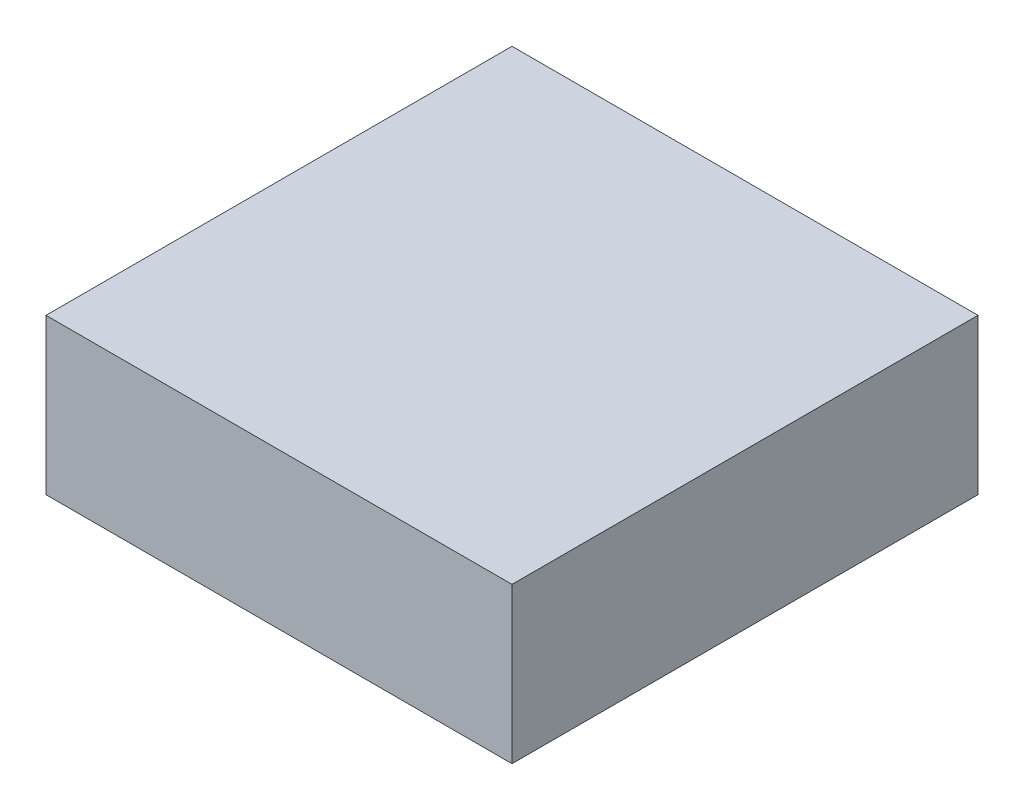
from build123d import *

# Parameters (mm, degrees)
SKETCH11_W          = 81
SKETCH11_H          = 81
BOSS_EXTRUDE1_DEPTH = 27


with BuildPart() as part:
    # Sketch11 → Boss-Extrude1 (new body)
    with BuildSketch(Plane(origin=(0, 0, 0), x_dir=(1, 0, 0), z_dir=(0, 1, 0))):
        Rectangle(SKETCH11_W, SKETCH11_H)
    extrude(amount=BOSS_EXTRUDE1_DEPTH)

    # Sketch1 → Cut-Revolve1 (revolve, cut)
    with BuildSketch(Plane.XY):
        with BuildLine():
            Line((0, 25), (0, 10))
            Line((0, 10), (0, -10))
            Line((0, -10), (31.5, -10))
            Line((31.5, -10), (31.5, 0))
            add(Edge.make_bspline(
                [(0, 25), (1.37149288, 25), (4.090224786, 24.302680674), (10.751491586, 17.136812446), (25.578767024, 15.070162158), (31.038481607, 6.450242929), (31.5, 0)],
                knots=[0, 0, 0, 0, 0.091245862, 0.195023315, 0.675457006, 1, 1, 1, 1], degree=3))
        make_face()
    revolve(axis=Axis((0, 10, 0), (0, -1, 0)), mode=Mode.SUBTRACT)


solid = part.part
